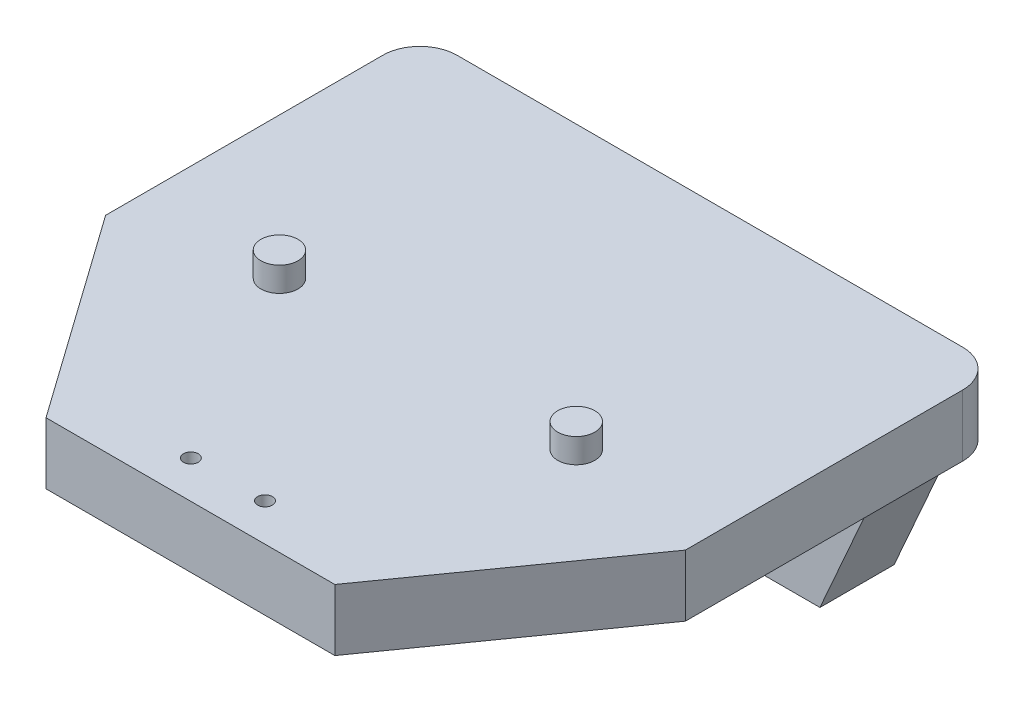
from build123d import *

# Parameters (mm, degrees)
BOSS_EXTRUDE1_DEPTH = 10
SKETCH2_W           = 78.14
SKETCH2_H           = 8.3
BOSS_EXTRUDE2_DEPTH = 60
SKETCH3_R           = 7.5
CUT_EXTRUDE1_DEPTH  = 10
FILLET1_R           = 5
CUT_EXTRUDE2_DEPTH  = 10
SKETCH5_R           = 2.5
BOSS_EXTRUDE3_DEPTH = 5
SKETCH7_R           = 1
CUT_EXTRUDE3_DEPTH  = 10


with BuildPart() as part:
    # Sketch1 → Boss-Extrude1 (new body)
    with BuildSketch(Plane.XY):
        Polygon((-104.14, 5), (-26, 5), (-26, -3.303087832), (-30.641562484, -3.303087832), (-40.234218738, -25), (-89.905781262, -25), (-99.498437516, -3.303087832), (-104.14, -3.303087832), align=None)
    extrude(amount=BOSS_EXTRUDE1_DEPTH)

    # Sketch2 → Boss-Extrude2 (add)
    with BuildSketch(Plane.XY.offset(10)):
        with Locations((-65.07, 0.85)):
            Rectangle(SKETCH2_W, SKETCH2_H)
    extrude(amount=BOSS_EXTRUDE2_DEPTH)

    # Sketch3 → Cut-Extrude1 (cut)
    with BuildSketch(Plane.XY.offset(10)):
        with Locations((-65.07, -13.5)):
            Circle(SKETCH3_R)
    extrude(amount=-CUT_EXTRUDE1_DEPTH, mode=Mode.SUBTRACT)

    # Fillet1
    fillet1_edges = [part.edges().sort_by_distance(p)[0] for p in [
        (-26, 0.848456084, 0),
        (-104.14, 0.848456084, 0),
    ]]
    fillet(fillet1_edges, radius=FILLET1_R)

    # Sketch4 → Cut-Extrude2 (cut)
    with BuildSketch(Plane.XZ.offset(3.3)):
        Polygon((-84.531238134, 70), (-104.14, 42.355810036), (-104.14, 70), align=None)
        Polygon((-45.608761866, 70), (-26, 42.355810036), (-26, 70), align=None)
    extrude(amount=-CUT_EXTRUDE2_DEPTH, mode=Mode.SUBTRACT)

    # Sketch5 → Boss-Extrude3 (add)
    with BuildSketch(Plane.XZ.offset(3.3)):
        with Locations(Location((-85.07, 38, 0), (0, 0, 90))):
            Circle(SKETCH5_R)
        with Locations(Location((-45.07, 38, 0), (0, 0, 90))):
            Circle(SKETCH5_R)
    boss_extrude3 = extrude(amount=BOSS_EXTRUDE3_DEPTH)

    # Mirror1: Boss-Extrude3 across plane
    add(boss_extrude3.mirror(Plane.ZX))

    # Sketch7 → Cut-Extrude3 (cut)
    with BuildSketch(Plane.XZ.offset(3.3)):
        with Locations(Location((-60.07, 64.945333525, 0), (0, 0, 270))):
            Circle(SKETCH7_R)
        with Locations(Location((-70.07, 64.945333525, 0), (0, 0, 270))):
            Circle(SKETCH7_R)
    extrude(amount=-CUT_EXTRUDE3_DEPTH, mode=Mode.SUBTRACT)


solid = part.part
